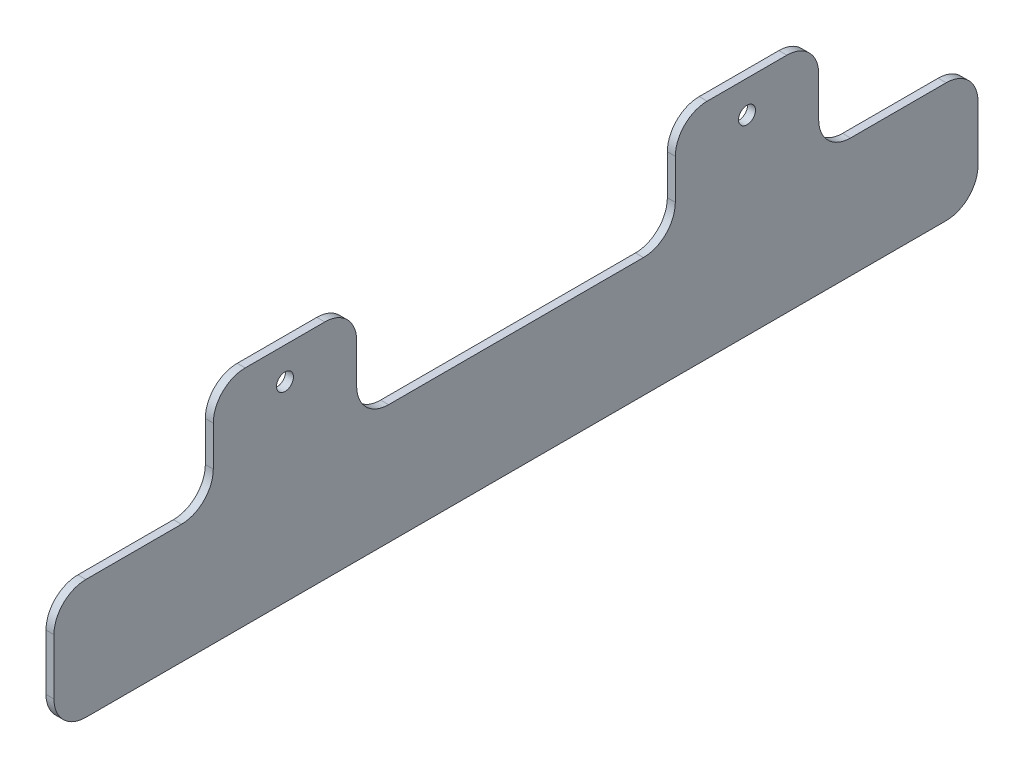
from build123d import *

# Parameters (mm, degrees)
SKETCH1_R           = 3.3734375
BOSS_EXTRUDE1_DEPTH = 3.175


with BuildPart() as part:
    # Sketch1 → Boss-Extrude1 (new body)
    with BuildSketch(Plane(origin=(0, 0, 0), x_dir=(0, 0, -1), z_dir=(1, 0, 0))):
        with BuildLine():
            Line((12.7, 0), (355.6, 0))
            ThreePointArc((355.6, 0), (364.580256121, 3.719743879), (368.3, 12.7))
            Line((368.3, 12.7), (368.3, 34.925))
            ThreePointArc((368.3, 34.925), (364.580256121, 43.905256121), (355.6, 47.625))
            Line((355.6, 47.625), (317.5, 47.625))
            ThreePointArc((317.5, 47.625), (308.519743879, 51.344743879), (304.8, 60.325))
            Line((304.8, 60.325), (304.8, 76.2))
            ThreePointArc((304.8, 76.2), (301.080256121, 85.180256121), (292.1, 88.9))
            Line((292.1, 88.9), (260.35, 88.9))
            ThreePointArc((260.35, 88.9), (251.369743879, 85.180256121), (247.65, 76.2))
            Line((247.65, 76.2), (247.65, 60.325))
            ThreePointArc((247.65, 60.325), (243.930256121, 51.344743879), (234.95, 47.625))
            Line((234.95, 47.625), (133.35, 47.625))
            ThreePointArc((133.35, 47.625), (124.369743879, 51.344743879), (120.65, 60.325))
            Line((120.65, 60.325), (120.65, 76.2))
            ThreePointArc((120.65, 76.2), (116.930256121, 85.180256121), (107.95, 88.9))
            Line((107.95, 88.9), (76.2, 88.9))
            ThreePointArc((76.2, 88.9), (67.219743879, 85.180256121), (63.5, 76.2))
            Line((63.5, 76.2), (63.5, 60.325))
            ThreePointArc((63.5, 60.325), (59.780256121, 51.344743879), (50.8, 47.625))
            Line((50.8, 47.625), (12.7, 47.625))
            ThreePointArc((12.7, 47.625), (3.719743879, 43.905256121), (0, 34.925))
            Line((0, 34.925), (0, 12.7))
            ThreePointArc((0, 12.7), (3.719743879, 3.719743879), (12.7, 0))
        make_face()
        with Locations((92.075, 76.2)):
            Circle(SKETCH1_R, mode=Mode.SUBTRACT)
        with Locations((276.225, 76.2)):
            Circle(SKETCH1_R, mode=Mode.SUBTRACT)
    extrude(amount=BOSS_EXTRUDE1_DEPTH)


solid = part.part
